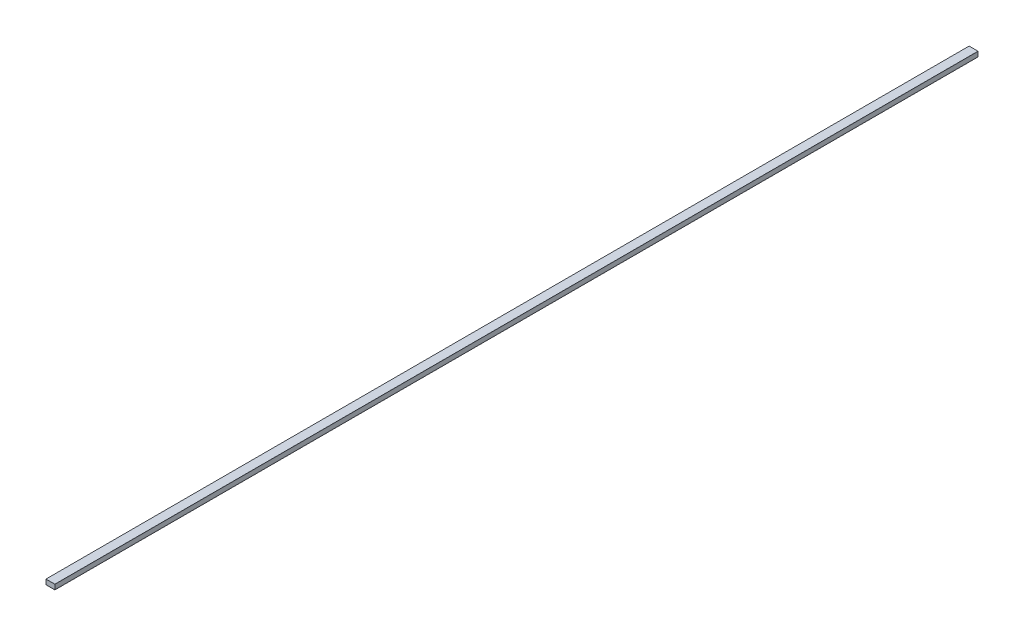
from build123d import *

# Parameters (mm, degrees)
CORE_SKETCH_W  = 6.35
CORE_SKETCH_H  = 3.175
CORE_DEPTH     = 329.946
FLANGE_DEPTH   = 329.946
FLANGE_2_DEPTH = 329.946


with BuildPart() as part:
    # Core Sketch → Core (new, symmetric)
    with BuildSketch(Plane.XY):
        Rectangle(CORE_SKETCH_W, CORE_SKETCH_H)
    extrude(amount=CORE_DEPTH, both=True)


with BuildPart() as body_2:
    # Flange Sketch → Flange (new, symmetric)
    with BuildSketch(Plane.XY):
        Polygon((0, 1.5875), (3.175, 1.5875), (3.175, 1.787500108), (-3.175, 1.787500108), (-3.175, 1.5875), align=None)
    extrude(amount=FLANGE_DEPTH, both=True)


with BuildPart() as body_3:
    # Flange Sketch → Flange 2 (new, symmetric)
    with BuildSketch(Plane.XY):
        Polygon((0, -1.5875), (3.175, -1.5875), (3.175, -1.787500108), (-3.175, -1.787500108), (-3.175, -1.5875), align=None)
    extrude(amount=FLANGE_2_DEPTH, both=True)


solid = Compound([part.part, body_2.part, body_3.part])
